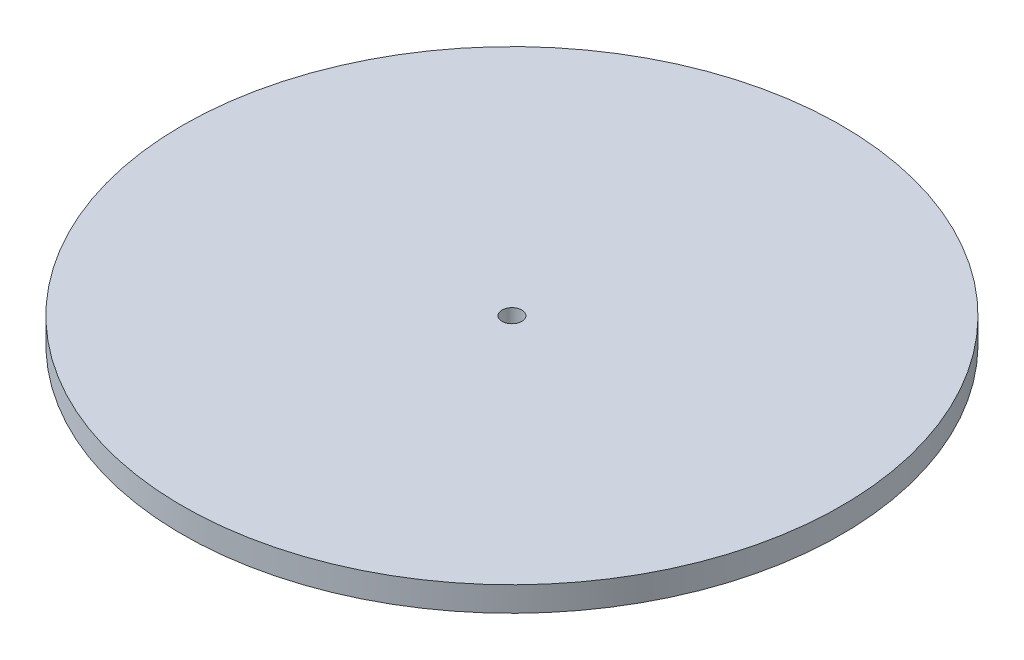
from build123d import *

# Parameters (mm, degrees)
SKETCH5_R          = 1.2
CUT_EXTRUDE1_DEPTH = 62.428828527


with BuildPart() as part:
    # Sketch3 → Revolve4 (revolve)
    with BuildSketch(Plane.XY, mode=Mode.PRIVATE) as revolve4_sk:
        with BuildLine():
            Line((1.2, 23.947209718), (1.2, 18.947209718))
            Line((1.2, 18.947209718), (0, 18.947209718))
            Line((0, 18.947209718), (0, 0))
            add(Edge.make_bspline(
                [(0, 0), (4.111111152, -0.066244065), (8.222222237, 3.576705393), (12.333333353, 5.572763044), (16.444444455, 8.284281239), (20.555555558, 10.96940007), (24.666666671, 13.080542412), (28.777777776, 15.599404704), (32.888888888, 17.759964468), (37, 19.947209718)],
                knots=[0.079250207, 0.079250207, 0.079250207, 0.079250207, 0.079250207, 0.079250207, 0.079250207, 0.079250207, 0.079250207, 0.079250207, 0.916390411, 0.916390411, 0.916390411, 0.916390411, 0.916390411, 0.916390411, 0.916390411, 0.916390411, 0.916390411, 0.916390411], degree=9))
            Line((37, 19.947209718), (37, 20.947209718))
            Line((37, 20.947209718), (40, 20.947209718))
            Line((40, 20.947209718), (40, 23.947209718))
            Line((40, 23.947209718), (1.2, 23.947209718))
        make_face()
    revolve(revolve4_sk.sketch.rotate(Axis((0, 23.947209718, 0), (0, -1, 0)), 180), axis=Axis((0, 23.947209718, 0), (0, -1, 0)))

    # Sketch5 → Cut-Extrude1 (cut, through all)
    with BuildSketch(Plane(origin=(0, 23.947209718, 0), x_dir=(1, 0, 0), z_dir=(0, 1, 0))):
        with Locations(Location((0, 0, 0), (0, 0, 180))):
            Circle(SKETCH5_R)
    extrude(amount=-CUT_EXTRUDE1_DEPTH, mode=Mode.SUBTRACT)


solid = part.part
